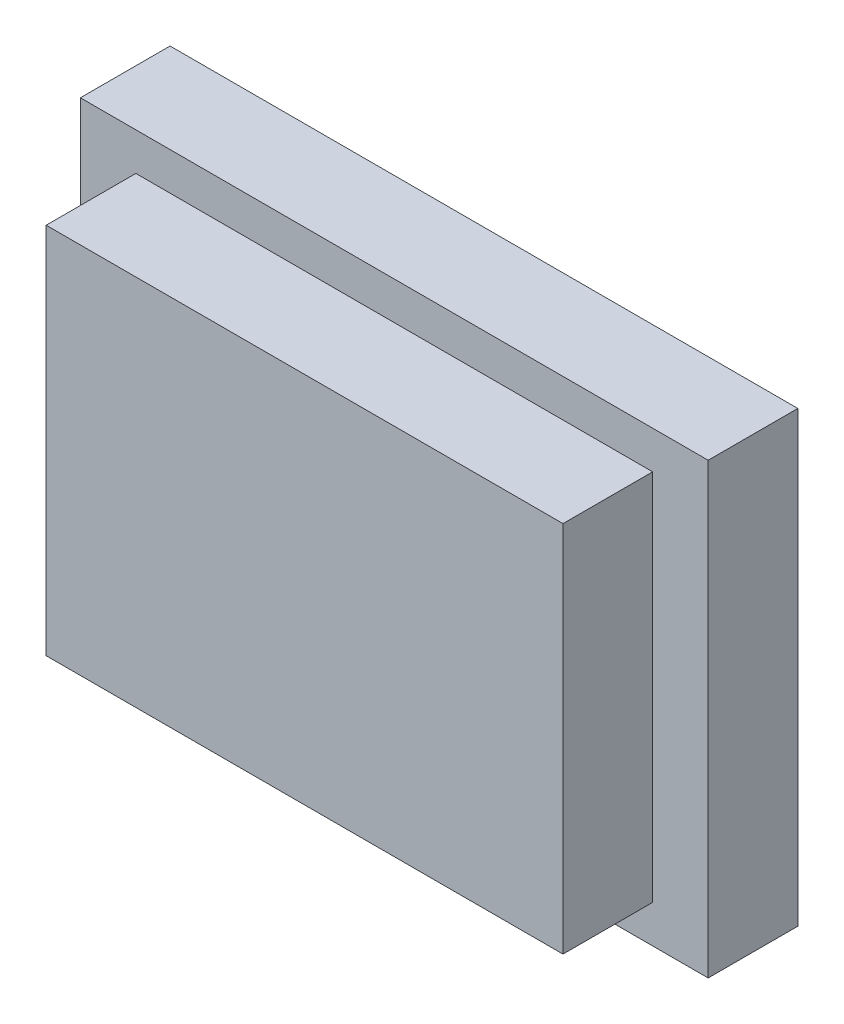
from build123d import *

# Parameters (mm, degrees)
SKETCH1_W           = 21
SKETCH1_H           = 15
BOSS_EXTRUDE1_DEPTH = 3
SKETCH2_W           = 17.288409024
SKETCH2_H           = 12.472568428
BOSS_EXTRUDE2_DEPTH = 3


with BuildPart() as part:
    # Sketch1 → Boss-Extrude1 (new body)
    with BuildSketch(Plane.XY):
        Rectangle(SKETCH1_W, SKETCH1_H)
    extrude(amount=BOSS_EXTRUDE1_DEPTH)

    # Sketch2 → Boss-Extrude2 (add)
    with BuildSketch(Plane.XY.offset(3)):
        Rectangle(SKETCH2_W, SKETCH2_H)
    extrude(amount=BOSS_EXTRUDE2_DEPTH)


solid = part.part
